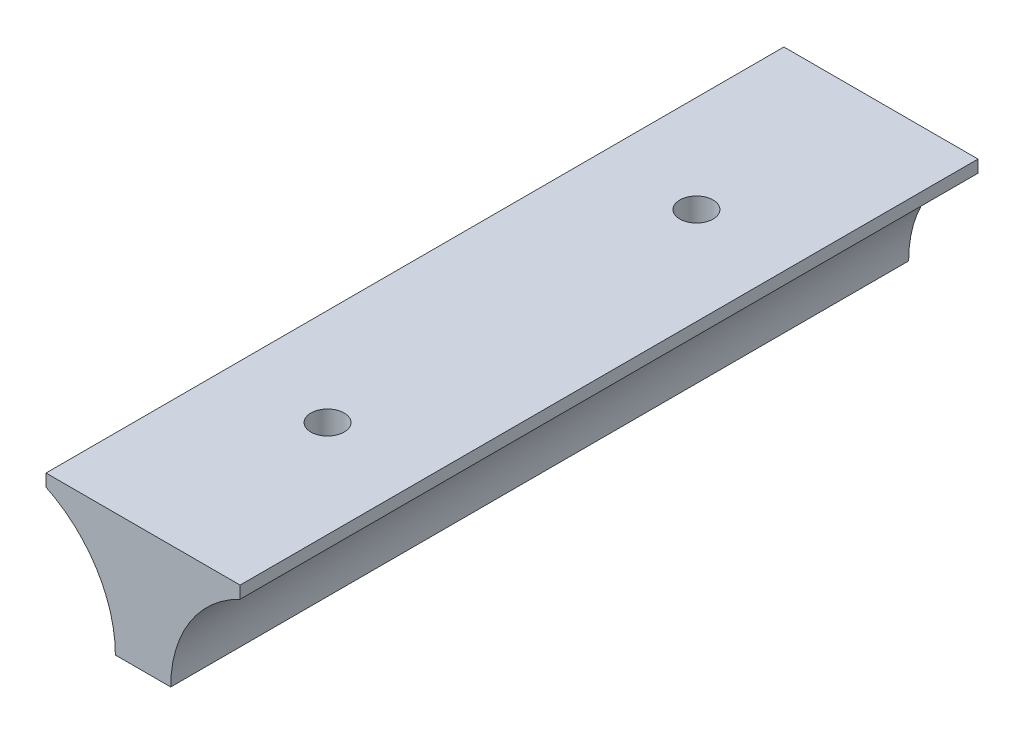
from build123d import *

# Parameters (mm, degrees)
BOSS_EXTRUDE1_DEPTH        = 60
F_2_7_2_7_DIAMETER_HOLE1_D = 2.7


with BuildPart() as part:
    # Sketch1 → Boss-Extrude1 (new body)
    with BuildSketch(Plane.XY):
        with BuildLine():
            Line((-2.25, 0), (2.25, 0))
            ThreePointArc((2.25, 0), (3.776836794, 5.310885546), (7.891101056, 9))
            Line((7.891101056, 9), (7.891101056, 10))
            Line((7.891101056, 10), (-7.891101056, 10))
            Line((-7.891101056, 10), (-7.891101056, 9))
            ThreePointArc((-7.891101056, 9), (-3.776836794, 5.310885546), (-2.25, 0))
        make_face()
    extrude(amount=BOSS_EXTRUDE1_DEPTH)

    # Ø2.7 (2.7) Diameter Hole1 (through all)
    with Locations(Plane(origin=(0, 10, 45), x_dir=(0, 0, 1), z_dir=(0, 1, 0))):
        with Locations((0, 0), (-30, 0)):
            Hole(F_2_7_2_7_DIAMETER_HOLE1_D / 2)


solid = part.part
